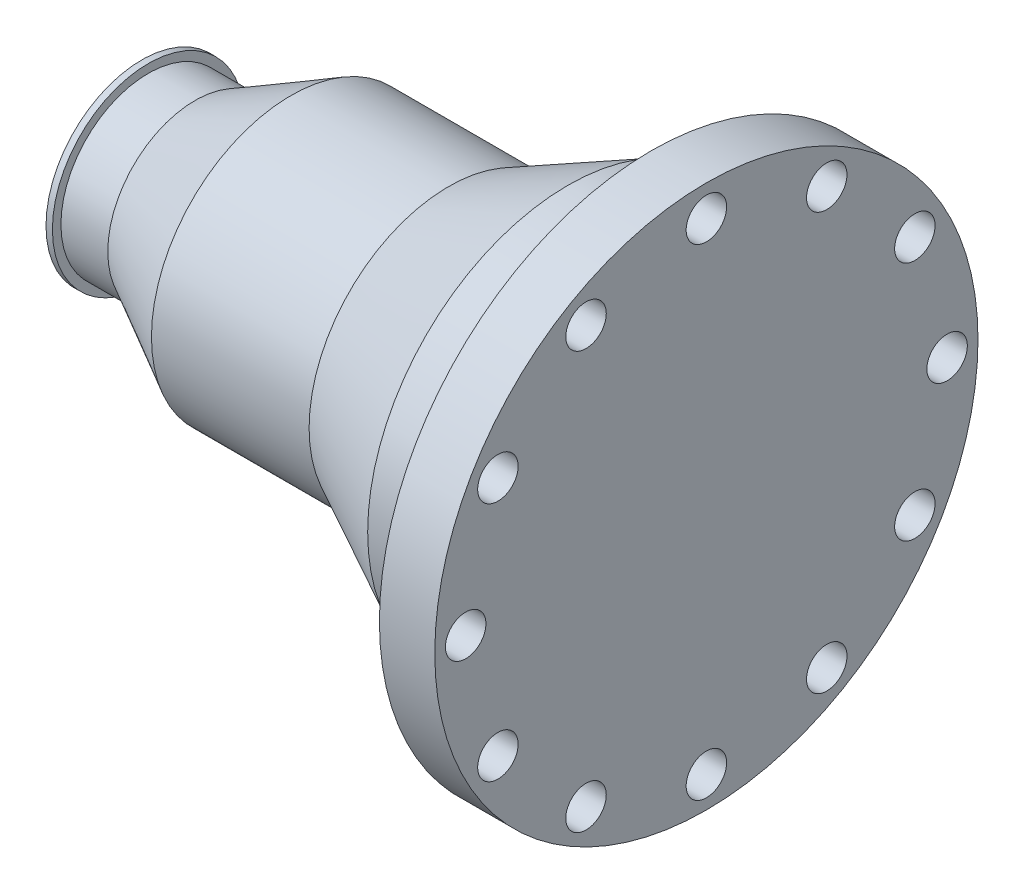
from build123d import *

# Parameters (mm, degrees)
SKETCH_3_R           = 9.5
CUT_EXTRUDE_1_DEPTH  = 321.526909947
SKETCH_4_R           = 9.5
CUT_EXTRUDE_2_DEPTH  = 321.526909947
SKETCH_5_R           = 9.5
CUT_EXTRUDE_3_DEPTH  = 321.526909947
SKETCH_6_R           = 9.5
CUT_EXTRUDE_4_DEPTH  = 321.526909947
SKETCH_7_R           = 9.5
CUT_EXTRUDE_5_DEPTH  = 321.526909947
SKETCH_8_R           = 9.5
CUT_EXTRUDE_6_DEPTH  = 321.526909947
SKETCH_9_R           = 9.5
CUT_EXTRUDE_7_DEPTH  = 321.526909947
SKETCH_10_R          = 9.5
CUT_EXTRUDE_8_DEPTH  = 321.526909947
SKETCH_11_R          = 9.5
CUT_EXTRUDE_9_DEPTH  = 321.526909947
SKETCH_12_R          = 9.5
CUT_EXTRUDE_10_DEPTH = 321.526909947
SKETCH_13_R          = 9.5
CUT_EXTRUDE_11_DEPTH = 321.526909947
SKETCH_14_R          = 9.5
CUT_EXTRUDE_12_DEPTH = 321.526909947


with BuildPart() as part:
    # Эскиз1 → Повернуть1 (revolve)
    with BuildSketch(Plane.XY, mode=Mode.PRIVATE) as revolve_1_sk:
        Polygon((0, 0), (265, 0), (265, 127.5), (239, 127.5), (239, 100), (239, 95), (220, 95), (220, 94), (200, 94), (144, 65.5), (70, 65.5), (25, 41), (3, 41), (3, 45), (0, 45), align=None)
    revolve(revolve_1_sk.sketch.rotate(Axis((0, 0, 0), (1, 0, 0)), 90), axis=Axis((0, 0, 0), (1, 0, 0)))

    # Эскиз2 → Вырез-Повернуть1 (revolve, cut)
    with BuildSketch(Plane.XY, mode=Mode.PRIVATE) as cut_revolve_1_sk:
        with BuildLine():
            Line((0, 0), (257, 0))
            Line((257, 0), (257, 34))
            Line((257, 34), (239, 34))
            Line((239, 34), (226, 47))
            Line((226, 47), (203.5, 47))
            Line((203.5, 47), (203.5, 55))
            Line((203.5, 55), (147.669872, 55))
            ThreePointArc((147.669872, 55), (146.273624348, 54.108499061), (146.669872, 52.5))
            Line((146.669872, 52.5), (143.5, 52.5))
            ThreePointArc((143.5, 52.5), (142.75, 52.602347572), (142, 52.5))
            Line((142, 52.5), (90, 52.5))
            ThreePointArc((90, 52.5), (79.13262933, 46.740617582), (70, 38.502577))
            Line((70, 38.502577), (42, 31))
            Line((42, 31), (0, 31))
            Line((0, 31), (0, 0))
        make_face()
    revolve(cut_revolve_1_sk.sketch.rotate(Axis((0, 0, 0), (1, 0, 0)), 90), axis=Axis((0, 0, 0), (1, 0, 0)), mode=Mode.SUBTRACT)

    # Эскиз3 → Вырез-Вытянуть1 (cut, through all)
    with BuildSketch(Plane(origin=(0, 0, 0), x_dir=(0, 0, -1), z_dir=(1, 0, 0))):
        with Locations((0, 113)):
            Circle(SKETCH_3_R)
    extrude(amount=CUT_EXTRUDE_1_DEPTH, mode=Mode.SUBTRACT)

    # Эскиз4 → Вырез-Вытянуть2 (cut, through all)
    with BuildSketch(Plane(origin=(0, 0, 0), x_dir=(0, 0, -1), z_dir=(1, 0, 0))):
        with Locations((-56.5, 97.860870628)):
            Circle(SKETCH_4_R)
    extrude(amount=CUT_EXTRUDE_2_DEPTH, mode=Mode.SUBTRACT)

    # Эскиз5 → Вырез-Вытянуть3 (cut, through all)
    with BuildSketch(Plane(origin=(0, 0, 0), x_dir=(0, 0, -1), z_dir=(1, 0, 0))):
        with Locations((-97.860870628, 56.5)):
            Circle(SKETCH_5_R)
    extrude(amount=CUT_EXTRUDE_3_DEPTH, mode=Mode.SUBTRACT)

    # Эскиз6 → Вырез-Вытянуть4 (cut, through all)
    with BuildSketch(Plane(origin=(0, 0, 0), x_dir=(0, 0, -1), z_dir=(1, 0, 0))):
        with Locations((-113, 0)):
            Circle(SKETCH_6_R)
    extrude(amount=CUT_EXTRUDE_4_DEPTH, mode=Mode.SUBTRACT)

    # Эскиз7 → Вырез-Вытянуть5 (cut, through all)
    with BuildSketch(Plane(origin=(0, 0, 0), x_dir=(0, 0, -1), z_dir=(1, 0, 0))):
        with Locations((-97.860870628, -56.5)):
            Circle(SKETCH_7_R)
    extrude(amount=CUT_EXTRUDE_5_DEPTH, mode=Mode.SUBTRACT)

    # Эскиз8 → Вырез-Вытянуть6 (cut, through all)
    with BuildSketch(Plane(origin=(0, 0, 0), x_dir=(0, 0, -1), z_dir=(1, 0, 0))):
        with Locations((-56.5, -97.860870628)):
            Circle(SKETCH_8_R)
    extrude(amount=CUT_EXTRUDE_6_DEPTH, mode=Mode.SUBTRACT)

    # Эскиз9 → Вырез-Вытянуть7 (cut, through all)
    with BuildSketch(Plane(origin=(0, 0, 0), x_dir=(0, 0, -1), z_dir=(1, 0, 0))):
        with Locations((0, -113)):
            Circle(SKETCH_9_R)
    extrude(amount=CUT_EXTRUDE_7_DEPTH, mode=Mode.SUBTRACT)

    # Эскиз10 → Вырез-Вытянуть8 (cut, through all)
    with BuildSketch(Plane(origin=(0, 0, 0), x_dir=(0, 0, -1), z_dir=(1, 0, 0))):
        with Locations((56.5, -97.860870628)):
            Circle(SKETCH_10_R)
    extrude(amount=CUT_EXTRUDE_8_DEPTH, mode=Mode.SUBTRACT)

    # Эскиз11 → Вырез-Вытянуть9 (cut, through all)
    with BuildSketch(Plane(origin=(0, 0, 0), x_dir=(0, 0, -1), z_dir=(1, 0, 0))):
        with Locations((97.860870628, -56.5)):
            Circle(SKETCH_11_R)
    extrude(amount=CUT_EXTRUDE_9_DEPTH, mode=Mode.SUBTRACT)

    # Эскиз12 → Вырез-Вытянуть10 (cut, through all)
    with BuildSketch(Plane(origin=(0, 0, 0), x_dir=(0, 0, -1), z_dir=(1, 0, 0))):
        with Locations((113, 0)):
            Circle(SKETCH_12_R)
    extrude(amount=CUT_EXTRUDE_10_DEPTH, mode=Mode.SUBTRACT)

    # Эскиз13 → Вырез-Вытянуть11 (cut, through all)
    with BuildSketch(Plane(origin=(0, 0, 0), x_dir=(0, 0, -1), z_dir=(1, 0, 0))):
        with Locations((97.860870628, 56.5)):
            Circle(SKETCH_13_R)
    extrude(amount=CUT_EXTRUDE_11_DEPTH, mode=Mode.SUBTRACT)

    # Эскиз14 → Вырез-Вытянуть12 (cut, through all)
    with BuildSketch(Plane(origin=(0, 0, 0), x_dir=(0, 0, -1), z_dir=(1, 0, 0))):
        with Locations((56.5, 97.860870628)):
            Circle(SKETCH_14_R)
    extrude(amount=CUT_EXTRUDE_12_DEPTH, mode=Mode.SUBTRACT)


solid = part.part
